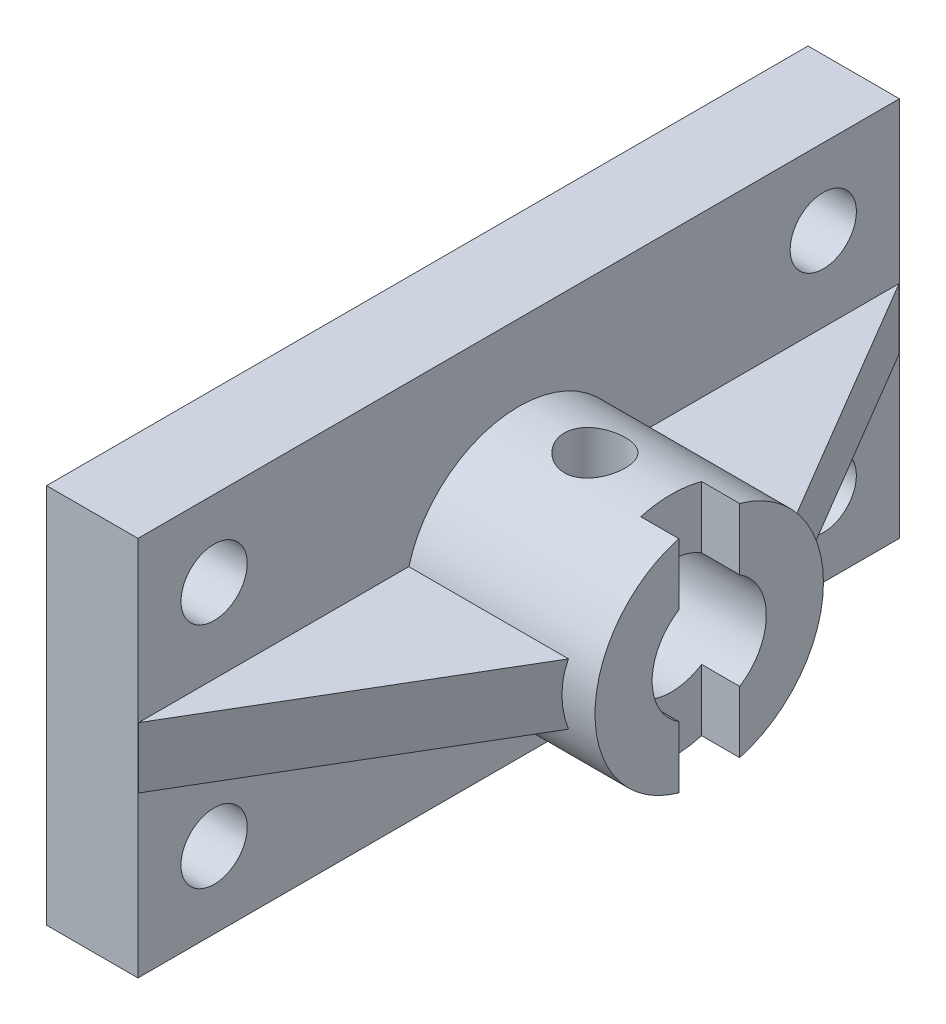
from build123d import *

# Parameters (mm, degrees)
SKETCH_1_W               = 100
SKETCH_1_H               = 50
EXTRUDE_1_DEPTH          = 12
SKETCH_2_R               = 15
SKETCH_2_R_2             = 7.5
EXTRUDE_3_DEPTH          = 25
EXTRUDE_20_DEPTH         = 4
SKETCH_7_R               = 7.5
CUT_EXTRUDE_2_DEPTH      = 115.564392374
CUT_EXTRUDE_4_DEPTH      = 110.517121949
CUT_EXTRUDE_4_DEPTH_BACK = 110.517121949
CUT_EXTRUDE_5_DEPTH      = 110.517121949
CUT_EXTRUDE_5_DEPTH_BACK = 110.517121949
SKETCH_9_R               = 4
SKETCH_10_R              = 4.349058231
CUT_EXTRUDE_6_DEPTH      = 115.564392396


with BuildPart() as part:
    # 草图1 → 凸台-拉伸1 (new body)
    with BuildSketch(Plane(origin=(0, 0, 0), x_dir=(0, 0, -1), z_dir=(1, 0, 0))):
        with Locations((50, 25)):
            Rectangle(SKETCH_1_W, SKETCH_1_H)
    extrude(amount=EXTRUDE_1_DEPTH)

    # 草图2 → 凸台-拉伸3 (add)
    with BuildSketch(Plane(origin=(12, 0, 0), x_dir=(0, 0, -1), z_dir=(1, 0, 0))):
        with Locations((50.025247728, 25)):
            Circle(SKETCH_2_R)
        with Locations((50.025247728, 25)):
            Circle(SKETCH_2_R_2, mode=Mode.SUBTRACT)
    extrude(amount=EXTRUDE_3_DEPTH)

    # 草图6 → 凸台-拉伸20 (add, symmetric)
    with BuildSketch(Plane(origin=(0, 25, 0), x_dir=(1, 0, 0), z_dir=(0, 1, 0))):
        Polygon((11.607924721, 61.899802302), (11.974710876, 100), (34.498075292, 61.899802302), align=None)
        Polygon((11.607924721, 38.150693154), (34.498075292, 38.150693154), (11.974710876, 0.050495456), align=None)
    extrude(amount=EXTRUDE_20_DEPTH, both=True)

    # 草图7 → 切除-拉伸2 (cut, through all)
    with BuildSketch(Plane(origin=(12, 0, 0), x_dir=(0, 0, -1), z_dir=(1, 0, 0))):
        with Locations((50.025247728, 25)):
            Circle(SKETCH_7_R)
    extrude(amount=-CUT_EXTRUDE_2_DEPTH, mode=Mode.SUBTRACT)

    # 草图8 → 切除-拉伸4 (cut, two sides: drawn at the far end of the back side and taken through both)
    with BuildSketch(Plane(origin=(0, 25, 0), x_dir=(1, 0, 0), z_dir=(0, 1, 0)).offset(-CUT_EXTRUDE_4_DEPTH_BACK)):
        Polygon((37, 54.025247728), (32, 54.025247728), (32, 46.025247728), (37, 46.025247728), (37, 50.025247728), align=None)
    extrude(amount=CUT_EXTRUDE_4_DEPTH + CUT_EXTRUDE_4_DEPTH_BACK, mode=Mode.SUBTRACT)

    # 草图9 → 切除-拉伸5 (cut, two sides: drawn at the far end of the back side and taken through both)
    with BuildSketch(Plane(origin=(0, 25, 0), x_dir=(1, 0, 0), z_dir=(0, 1, 0)).offset(-CUT_EXTRUDE_5_DEPTH_BACK)):
        with Locations(Location((22, 50.007690545, 0), (0, 0, 270))):
            Circle(SKETCH_9_R)
    extrude(amount=CUT_EXTRUDE_5_DEPTH + CUT_EXTRUDE_5_DEPTH_BACK, mode=Mode.SUBTRACT)

    # 草图10 → 切除-拉伸6 (cut, through all)
    with BuildSketch(Plane(origin=(12, 0, 0), x_dir=(0, 0, -1), z_dir=(1, 0, 0))):
        with Locations((10, 40)):
            Circle(SKETCH_10_R)
        with Locations(Location((10, 10, 0), (0, 0, 180))):
            Circle(SKETCH_10_R)
        with Locations((90, 10)):
            Circle(SKETCH_10_R)
        with Locations(Location((90, 40, 0), (0, 0, 180))):
            Circle(SKETCH_10_R)
    extrude(amount=-CUT_EXTRUDE_6_DEPTH, mode=Mode.SUBTRACT)


solid = part.part
